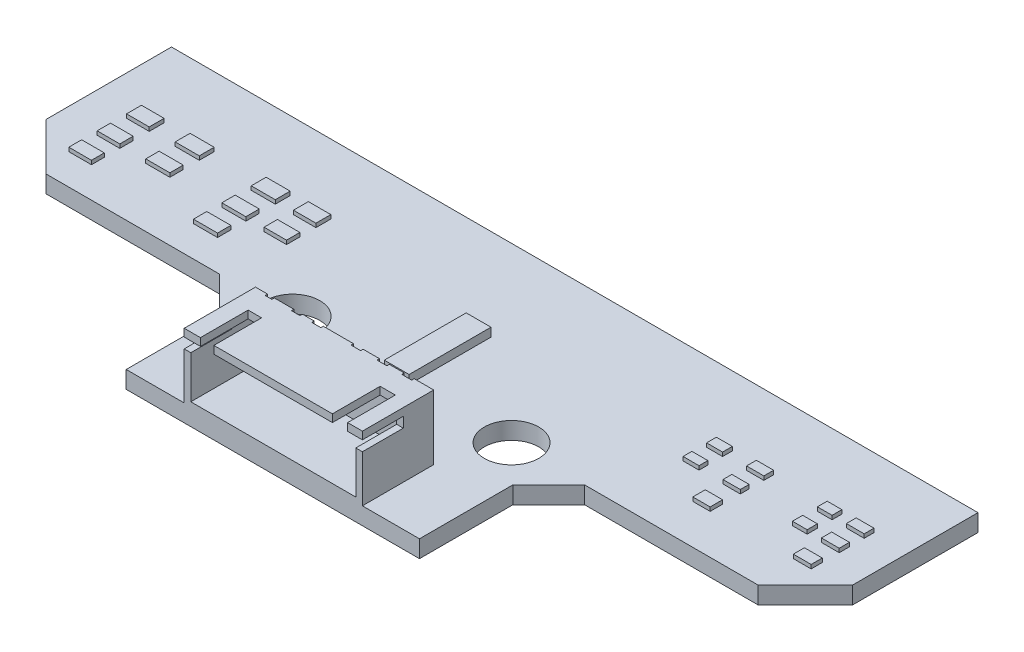
from build123d import *

# Parameters (mm, degrees)
SKETCH_2_R          = 3.154857366
EXTRUDE_1_DEPTH     = 2
SKETCH_3_W          = 20.655711076
SKETCH_3_H          = 8.265039228
EXTRUDE_2_DEPTH     = 0.5
EXTRUDE_5_DEPTH     = 0.5
SKETCH_6_W          = 8.265039228
SKETCH_6_H          = 0.410219783
EXTRUDE_6_DEPTH     = 20
SKETCH_11_W         = 20.5
SKETCH_11_H         = 8.265039228
CUT_EXTRUDE_1_DEPTH = 0.5
CUT_EXTRUDE_2_DEPTH = 0.5
SKETCH_13_W         = 0.765026337
SKETCH_13_H         = 8.265039228
EXTRUDE_13_DEPTH    = 7
SKETCH_14_W         = 4.735924231
SKETCH_14_H         = 1.186404479
CUT_EXTRUDE_3_DEPTH = 7
SKETCH_16_W         = 8.265039228
SKETCH_16_H         = 0.88395782
EXTRUDE_14_DEPTH    = 19.89
SKETCH_20_W         = 0.76502634
SKETCH_20_H         = 8.265039228
EXTRUDE_15_DEPTH    = 7
SKETCH_25_W         = 4.74
SKETCH_25_H         = 1.19
CUT_EXTRUDE_4_DEPTH = 7
SKETCH_26_W         = 1.559263594
SKETCH_26_H         = 5.530672927
CUT_EXTRUDE_5_DEPTH = 1
SKETCH_27_W         = 1.761256615
SKETCH_27_H         = 5.530672927
CUT_EXTRUDE_6_DEPTH = 1
EXTRUDE_16_DEPTH    = 7
SKETCH_29_W         = 0.770164419
SKETCH_29_H         = 0.286274695
SKETCH_29_W_2       = 0.993106751
SKETCH_29_W_3       = 1.053909206
SKETCH_29_W_4       = 1.11471166
SKETCH_29_W_5       = 1.155246629
CUT_EXTRUDE_7_DEPTH = 10
SKETCH_30_W         = 2.878771359
SKETCH_30_H         = 9.493820439
EXTRUDE_17_DEPTH    = 1
SKETCH_31_W         = 2.066379312
SKETCH_31_H         = 1.136508622
SKETCH_31_H_2       = 1.188168105
SKETCH_31_H_3       = 1.29148707
SKETCH_31_W_2       = 1.704762933
EXTRUDE_18_DEPTH    = 0.45
SKETCH_32_W         = 2.006660951
SKETCH_32_H         = 1.136508622
SKETCH_32_H_2       = 1.025025214
SKETCH_32_H_3       = 1.440679657
SKETCH_32_W_2       = 1.852302416
EXTRUDE_19_DEPTH    = 0.45
SKETCH_33_W         = 2.603637934
SKETCH_33_H         = 1.726620083
SKETCH_33_H_2       = 1.549784484
SKETCH_33_H_3       = 1.487793105
SKETCH_33_W_2       = 2.789612072
SKETCH_33_W_3       = 2.796083246
SKETCH_33_W_4       = 2.626623655
EXTRUDE_20_DEPTH    = 0.45
SKETCH_34_R         = 0.102646287
EXTRUDE_21_DEPTH    = 4
SKETCH_34_R_2       = 0.113756213
EXTRUDE_21_2_DEPTH  = 4
SKETCH_34_R_3       = 0.117637046
EXTRUDE_21_3_DEPTH  = 4
SKETCH_34_R_4       = 0.104002548
EXTRUDE_21_4_DEPTH  = 4
SKETCH_34_R_5       = 0.109885316
EXTRUDE_21_5_DEPTH  = 4
SKETCH_34_R_6       = 0.080160991
EXTRUDE_21_6_DEPTH  = 4
SKETCH_36_R         = 0.134874188
SKETCH_36_R_2       = 0.162097203
SKETCH_36_R_3       = 0.182064681
SKETCH_36_R_4       = 0.160845353
SKETCH_36_R_5       = 0.163206425
SKETCH_36_R_6       = 0.195347838
EXTRUDE_22_DEPTH    = 5.5
SKETCH_39_W         = 2.796083246
SKETCH_39_H         = 1.487793105
CUT_EXTRUDE_8_DEPTH = 0.45
SKETCH_40_W         = 2.603637934
SKETCH_40_H         = 1.487793105
CUT_EXTRUDE_9_DEPTH = 0.45
SKETCH_41_W         = 2.789612072
SKETCH_41_H         = 1.542466772
EXTRUDE_23_DEPTH    = 0.45


with BuildPart() as part:
    # 草图2 → 凸台-拉伸1 (new body)
    with BuildSketch(Plane(origin=(0, 0, 0), x_dir=(1, 0, 0), z_dir=(0, 1, 0))):
        Polygon((-46.75, 0), (46.75, 0), (46.75, -14.546875), (41.28125, -20.015625), (21.15625, -20.015625), (17, -24.171875), (17, -35), (-17, -35), (-17, -24.171875), (-21.15625, -20.015625), (-41.28125, -20.015625), (-46.75, -14.546875), align=None)
        with Locations(Location((12.6875, -20.015625, 0), (0, 0, 270))):
            Circle(SKETCH_2_R, mode=Mode.SUBTRACT)
        with Locations(Location((-12.6875, -20.015625, 0), (0, 0, 90))):
            Circle(SKETCH_2_R, mode=Mode.SUBTRACT)
    extrude(amount=EXTRUDE_1_DEPTH)

    # 草图3 → 凸台-拉伸2 (add)
    with BuildSketch(Plane(origin=(0, 2, 0), x_dir=(1, 0, 0), z_dir=(0, 1, 0))):
        with Locations((0.054644738, -30.867480386)):
            Rectangle(SKETCH_3_W, SKETCH_3_H)
    extrude(amount=EXTRUDE_2_DEPTH)

    # 草图13 → 凸台-拉伸13 (add)
    with BuildSketch(Plane(origin=(0, 2.5, 0), x_dir=(1, 0, 0), z_dir=(0, 1, 0))):
        with Locations((-9.890697632, -30.867480386)):
            Rectangle(SKETCH_13_W, SKETCH_13_H)
    extrude(amount=EXTRUDE_13_DEPTH)

    # 草图14 → 切除-拉伸3 (cut)
    with BuildSketch(Plane.ZY.offset(10.2732108)):
        with Locations((32.632037885, 8.022839941)):
            Rectangle(SKETCH_14_W, SKETCH_14_H)
    extrude(amount=-CUT_EXTRUDE_3_DEPTH, mode=Mode.SUBTRACT)

    # 草图16 → 凸台-拉伸14 (add)
    with BuildSketch(Plane(origin=(-9.508184463, 0, 0), x_dir=(0, 0, -1), z_dir=(1, 0, 0))):
        with Locations((-30.867480386, 9.05802109)):
            Rectangle(SKETCH_16_W, SKETCH_16_H)
    extrude(amount=EXTRUDE_14_DEPTH)

    # 草图20 → 凸台-拉伸15 (add)
    with BuildSketch(Plane(origin=(0, 2.5, 0), x_dir=(1, 0, 0), z_dir=(0, 1, 0))):
        with Locations((9.999987106, -30.867480386)):
            Rectangle(SKETCH_20_W, SKETCH_20_H)
    extrude(amount=EXTRUDE_15_DEPTH)

    # 草图25 → 切除-拉伸4 (cut)
    with BuildSketch(Plane(origin=(10.382500276, 0, 0), x_dir=(0, 0, -1), z_dir=(1, 0, 0))):
        with Locations((-32.63, 8.025)):
            Rectangle(SKETCH_25_W, SKETCH_25_H)
    extrude(amount=-CUT_EXTRUDE_4_DEPTH, mode=Mode.SUBTRACT)

    # 草图26 → 切除-拉伸5 (cut)
    with BuildSketch(Plane(origin=(0, 9.5, 0), x_dir=(1, 0, 0), z_dir=(0, 1, 0))):
        with Locations((-7.615306271, -32.234663537)):
            Rectangle(SKETCH_26_W, SKETCH_26_H)
    extrude(amount=-CUT_EXTRUDE_5_DEPTH, mode=Mode.SUBTRACT)

    # 草图27 → 切除-拉伸6 (cut)
    with BuildSketch(Plane(origin=(0, 9.5, 0), x_dir=(1, 0, 0), z_dir=(0, 1, 0))):
        with Locations((7.788755594, -32.234663537)):
            Rectangle(SKETCH_27_W, SKETCH_27_H)
    extrude(amount=-CUT_EXTRUDE_6_DEPTH, mode=Mode.SUBTRACT)

    # 草图28 → 凸台-拉伸16 (add)
    with BuildSketch(Plane(origin=(0, 2.5, 0), x_dir=(1, 0, 0), z_dir=(0, 1, 0))):
        Polygon((9.617473936, -26.734960772), (9.617473936, -27.410910588), (-9.508184463, -27.226134624), (-9.508184463, -26.734960772), align=None)
    extrude(amount=EXTRUDE_16_DEPTH)

    # 草图29 → 切除-拉伸7 (cut)
    with BuildSketch(Plane(origin=(0, 9.5, 0), x_dir=(1, 0, 0), z_dir=(0, 1, 0))):
        with Locations((-8.479144579, -26.87809812)):
            Rectangle(SKETCH_29_W, SKETCH_29_H)
        with Locations((-5.327550705, -26.87809812)):
            Rectangle(SKETCH_29_W_2, SKETCH_29_H)
        with Locations((-2.94612125, -26.87809812)):
            Rectangle(SKETCH_29_W_3, SKETCH_29_H)
        with Locations((1.644464039, -26.87809812)):
            Rectangle(SKETCH_29_W_4, SKETCH_29_H)
        with Locations((4.664319263, -26.87809812)):
            Rectangle(SKETCH_29_W_5, SKETCH_29_H)
        with Locations((7.542302092, -26.87809812)):
            Rectangle(SKETCH_29_W_5, SKETCH_29_H)
    extrude(amount=-CUT_EXTRUDE_7_DEPTH, mode=Mode.SUBTRACT)

    # 草图30 → 凸台-拉伸17 (add)
    with BuildSketch(Plane(origin=(0, 2, 0), x_dir=(1, 0, 0), z_dir=(0, 1, 0))):
        with Locations((-0.536758872, -15.357951408)):
            Rectangle(SKETCH_30_W, SKETCH_30_H)
    extrude(amount=EXTRUDE_17_DEPTH)

    # 草图31 → 凸台-拉伸18 (add)
    with BuildSketch(Plane(origin=(0, 2, 0), x_dir=(1, 0, 0), z_dir=(0, 1, 0))):
        with Locations((41.695691755, -8.606814678)):
            Rectangle(SKETCH_31_W, SKETCH_31_H)
        with Locations((41.695691755, -11.473915975)):
            Rectangle(SKETCH_31_W, SKETCH_31_H_2)
        with Locations((41.695691755, -14.676803909)):
            Rectangle(SKETCH_31_W, SKETCH_31_H_3)
        with Locations((38.157017182, -8.606814678)):
            Rectangle(SKETCH_31_W_2, SKETCH_31_H)
        with Locations((38.157017182, -11.473915975)):
            Rectangle(SKETCH_31_W_2, SKETCH_31_H_2)
    extrude(amount=EXTRUDE_18_DEPTH)

    # 草图32 → 凸台-拉伸19 (add)
    with BuildSketch(Plane(origin=(0, 2, 0), x_dir=(1, 0, 0), z_dir=(0, 1, 0))):
        with Locations((30.096006813, -8.606814678)):
            Rectangle(SKETCH_32_W, SKETCH_32_H)
        with Locations((30.096006813, -11.392344529)):
            Rectangle(SKETCH_32_W, SKETCH_32_H_2)
        with Locations((30.096006813, -14.683310761)):
            Rectangle(SKETCH_32_W, SKETCH_32_H_3)
        Polygon((26.314222713, -8.038560367), (26.314222713, -9.175068989), (24.461920297, -9.175068989), (24.461920297, -8.038560367), (25.851147109, -8.038560367), align=None)
        with Locations((25.388071505, -11.392344529)):
            Rectangle(SKETCH_32_W_2, SKETCH_32_H_2)
    extrude(amount=EXTRUDE_19_DEPTH)

    # 草图33 → 凸台-拉伸20 (add)
    with BuildSketch(Plane(origin=(0, 2, 0), x_dir=(1, 0, 0), z_dir=(0, 1, 0))):
        with Locations((-21.5413958, -8.901870409)):
            Rectangle(SKETCH_33_W, SKETCH_33_H)
        with Locations((-21.5413958, -12.399814074)):
            Rectangle(SKETCH_33_W, SKETCH_33_H_2)
        with Locations((-21.5413958, -15.71635287)):
            Rectangle(SKETCH_33_W, SKETCH_33_H_3)
        Polygon((-24.950921666, -8.038560367), (-24.950921666, -9.76518045), (-27.740533738, -9.76518045), (-27.740533738, -8.038560367), (-25.818800977, -8.038560367), align=None)
        with Locations((-26.345727702, -12.399814074)):
            Rectangle(SKETCH_33_W_2, SKETCH_33_H_2)
        with Locations((-35.160312007, -8.901870409)):
            Rectangle(SKETCH_33_W_3, SKETCH_33_H)
        with Locations((-35.160312007, -12.399814074)):
            Rectangle(SKETCH_33_W_3, SKETCH_33_H_2)
        with Locations((-35.160312007, -15.71635287)):
            Rectangle(SKETCH_33_W_3, SKETCH_33_H_3)
        with Locations((-40.879573191, -8.901870409)):
            Rectangle(SKETCH_33_W_4, SKETCH_33_H)
        with Locations((-40.879573191, -12.399814074)):
            Rectangle(SKETCH_33_W_4, SKETCH_33_H_2)
        with Locations((-40.879573191, -15.71635287)):
            Rectangle(SKETCH_33_W_4, SKETCH_33_H_3)
    extrude(amount=EXTRUDE_20_DEPTH)

    # 草图36 → 凸台-拉伸22 (add)
    with BuildSketch(Plane(origin=(-0.263898767, 0, 27.315445108), x_dir=(0.9999533343022567, 0, 0.009660704829318849), z_dir=(-0.009660704829318849, 0, 0.9999533343022569))):
        with Locations(Location((-8.168176523, 7.387408185, 0), (0, 0, 180))):
            Circle(SKETCH_36_R)
        with Locations(Location((-4.910906123, 7.387408185, 0), (0, 0, 180))):
            Circle(SKETCH_36_R_2)
        with Locations(Location((-2.638859485, 7.387408185, 0), (0, 0, 180))):
            Circle(SKETCH_36_R_3)
        with Locations(Location((1.90523379, 7.387408185, 0), (0, 0, 180))):
            Circle(SKETCH_36_R_4)
        with Locations(Location((5.064803585, 7.387408185, 0), (0, 0, 180))):
            Circle(SKETCH_36_R_5)
        with Locations(Location((7.785492268, 7.387408185, 0), (0, 0, 180))):
            Circle(SKETCH_36_R_6)
    extrude(amount=EXTRUDE_22_DEPTH)

    # 草图39 → 切除-拉伸8 (cut)
    with BuildSketch(Plane(origin=(0, 2.45, 0), x_dir=(1, 0, 0), z_dir=(0, 1, 0))):
        with Locations((-35.160312007, -15.71635287)):
            Rectangle(SKETCH_39_W, SKETCH_39_H)
    extrude(amount=-CUT_EXTRUDE_8_DEPTH, mode=Mode.SUBTRACT)

    # 草图40 → 切除-拉伸9 (cut)
    with BuildSketch(Plane(origin=(0, 2.45, 0), x_dir=(1, 0, 0), z_dir=(0, 1, 0))):
        with Locations((-21.5413958, -15.71635287)):
            Rectangle(SKETCH_40_W, SKETCH_40_H)
    extrude(amount=-CUT_EXTRUDE_9_DEPTH, mode=Mode.SUBTRACT)

    # 草图41 → 凸台-拉伸23 (add)
    with BuildSketch(Plane(origin=(0, 2, 0), x_dir=(1, 0, 0), z_dir=(0, 1, 0))):
        with Locations((-26.345727702, -15.689016037)):
            Rectangle(SKETCH_41_W, SKETCH_41_H)
    extrude(amount=EXTRUDE_23_DEPTH)


with BuildPart() as body_2:
    # 草图5 → 凸台-拉伸5 (new body)
    with BuildSketch(Plane.ZY.offset(10.2732108)):
        Polygon((26.734960772, 2.5), (26.734960772, 7.243388141), (35, 7.243388141), (35, 6.179715161), (30.867480386, 6.179715161), (30.867480386, 5.156952679), (35, 5.156952679), (35, 2.5), align=None)
    extrude(amount=EXTRUDE_5_DEPTH)

    # 草图6 → 凸台-拉伸6 (add)
    with BuildSketch(Plane(origin=(-10.2732108, 0, 0), x_dir=(0, 0, -1), z_dir=(1, 0, 0))):
        with Locations((-30.867480386, 7.03827825)):
            Rectangle(SKETCH_6_W, SKETCH_6_H)
    extrude(amount=EXTRUDE_6_DEPTH)

    # 草图11 → 切除-拉伸1 (cut)
    with BuildSketch(Plane(origin=(0, 7.243388141, 0), x_dir=(1, 0, 0), z_dir=(0, 1, 0))):
        with Locations((-0.5232108, -30.867480386)):
            Rectangle(SKETCH_11_W, SKETCH_11_H)
    extrude(amount=-CUT_EXTRUDE_1_DEPTH, mode=Mode.SUBTRACT)

    # 草图12 → 切除-拉伸2 (cut)
    with BuildSketch(Plane.ZY.offset(10.7732108)):
        Polygon((26.734960772, 6.743388141), (35, 6.743388141), (35, 6.17406327), (30.867480386, 6.179715161), (30.867480386, 5.156952679), (35, 5.156952679), (35, 2.5), (26.734960772, 2.5), align=None)
    extrude(amount=-CUT_EXTRUDE_2_DEPTH, mode=Mode.SUBTRACT)


with BuildPart() as body_2_2:
    # 草图34 → 凸台-拉伸21 (new body)
    with BuildSketch(Plane(origin=(0, 2, 0), x_dir=(1, 0, 0), z_dir=(0, 1, 0))):
        with Locations(Location((-8.486159419, -26.873155681, 0), (0, 0, 270))):
            Circle(SKETCH_34_R)
    extrude(amount=EXTRUDE_21_DEPTH)


with BuildPart() as body_3:
    # 草图34 → Extrude 21 2 (new body)
    with BuildSketch(Plane(origin=(0, 2, 0), x_dir=(1, 0, 0), z_dir=(0, 1, 0))):
        with Locations(Location((-5.302990094, -26.873155681, 0), (0, 0, 270))):
            Circle(SKETCH_34_R_2)
    extrude(amount=EXTRUDE_21_2_DEPTH)


with BuildPart() as body_4:
    # 草图34 → Extrude 21 3 (new body)
    with BuildSketch(Plane(origin=(0, 2, 0), x_dir=(1, 0, 0), z_dir=(0, 1, 0))):
        with Locations(Location((-2.939388779, -26.873155681, 0), (0, 0, 270))):
            Circle(SKETCH_34_R_3)
    extrude(amount=EXTRUDE_21_3_DEPTH)


with BuildPart() as body_5:
    # 草图34 → Extrude 21 4 (new body)
    with BuildSketch(Plane(origin=(0, 2, 0), x_dir=(1, 0, 0), z_dir=(0, 1, 0))):
        with Locations(Location((1.653254419, -26.873155681, 0), (0, 0, 270))):
            Circle(SKETCH_34_R_4)
    extrude(amount=EXTRUDE_21_4_DEPTH)


with BuildPart() as body_6:
    # 草图34 → Extrude 21 5 (new body)
    with BuildSketch(Plane(origin=(0, 2, 0), x_dir=(1, 0, 0), z_dir=(0, 1, 0))):
        with Locations(Location((4.742917342, -26.873155681, 0), (0, 0, 270))):
            Circle(SKETCH_34_R_5)
    extrude(amount=EXTRUDE_21_5_DEPTH)


with BuildPart() as body_7:
    # 草图34 → Extrude 21 6 (new body)
    with BuildSketch(Plane(origin=(0, 2, 0), x_dir=(1, 0, 0), z_dir=(0, 1, 0))):
        with Locations(Location((7.543767912, -26.873155681, 0), (0, 0, 270))):
            Circle(SKETCH_34_R_6)
    extrude(amount=EXTRUDE_21_6_DEPTH)


solid = Compound([part.part, body_2_2.part, body_3.part, body_4.part, body_5.part, body_6.part, body_7.part])
